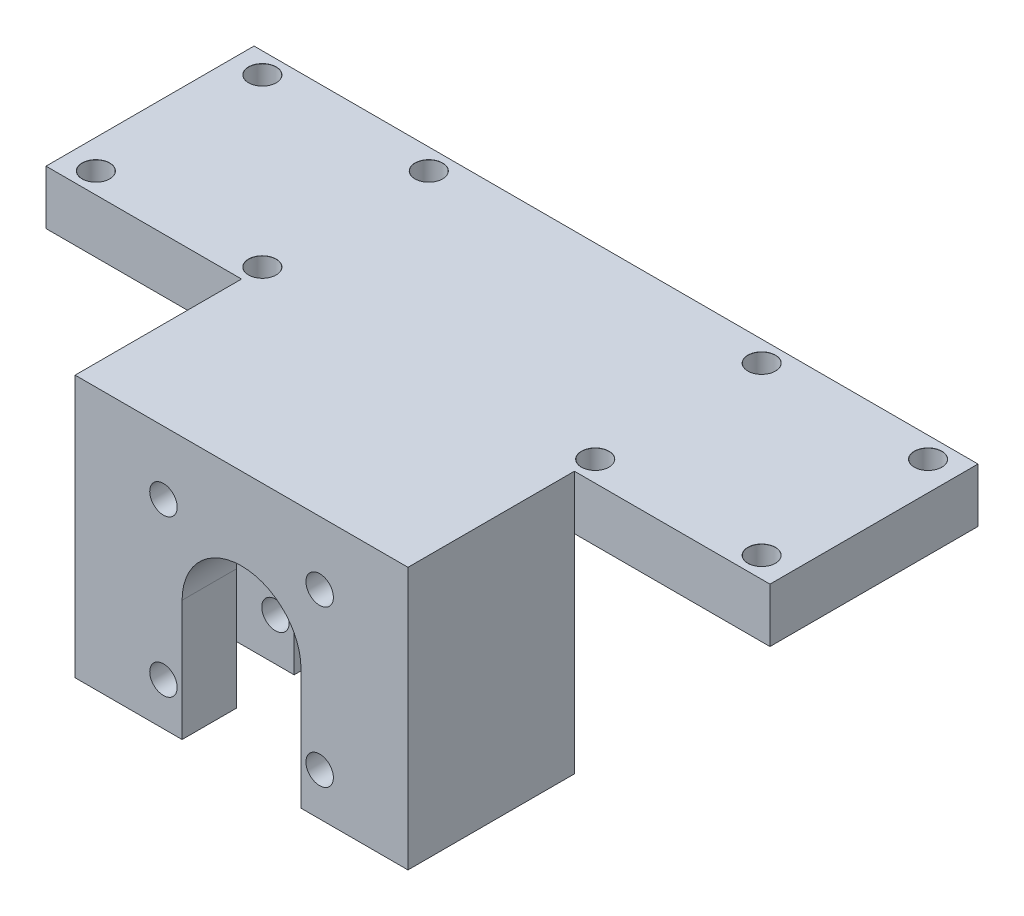
from build123d import *

# Parameters (mm, degrees)
SKETCH1_W                      = 174
SKETCH1_H                      = 50
BOSS_EXTRUDE1_DEPTH            = 13
M6_CLEARANCE_HOLE1_D           = 6.6
M6_CLEARANCE_HOLE1_CSINK_D     = 6.65
M6_CLEARANCE_HOLE1_CSINK_ANGLE = 100
SKETCH6_W                      = 80
SKETCH6_H                      = 13
BOSS_EXTRUDE2_DEPTH            = 40
SKETCH7_W                      = 80
SKETCH7_H                      = 40
BOSS_EXTRUDE3_DEPTH            = 50
CUT_EXTRUDE2_DEPTH             = 120.557517539
CUT_EXTRUDE2_DEPTH_BACK        = 120.557517539
SKETCH9_R                      = 14.29
M6_CLEARANCE_HOLE2_AT_2_COUNT  = 2
M6_CLEARANCE_HOLE2_AT_2_PITCH  = 37.540299013
M6_CLEARANCE_HOLE2_AT_3_COUNT  = 2
M6_CLEARANCE_HOLE2_AT_3_PITCH  = 37.540299013
M6_CLEARANCE_HOLE2_AT_4_COUNT  = 2
M6_CLEARANCE_HOLE2_AT_4_PITCH  = 53.09
CUT_EXTRUDE3_DEPTH             = 6.93
CUT_EXTRUDE3_DEPTH_BACK        = 6.93
SKETCH17_W                     = 28.58
SKETCH17_H                     = 29
CUT_EXTRUDE4_DEPTH             = 135.792433022
CUT_EXTRUDE5_DEPTH             = 50


with BuildPart() as part:
    # Sketch1 → Boss-Extrude1 (new body)
    with BuildSketch(Plane(origin=(0, 0, 0), x_dir=(1, 0, 0), z_dir=(0, 1, 0))):
        Rectangle(SKETCH1_W, SKETCH1_H)
    extrude(amount=BOSS_EXTRUDE1_DEPTH)

    # M6 Clearance Hole1 (through all)
    with Locations(Plane(origin=(0, 13, 0), x_dir=(1, 0, 0), z_dir=(0, 1, 0))):
        with Locations((-80, 20), (-40, 20), (-80, -20), (-40, -20), (40, 20), (80, 20), (40, -20), (80, -20)):
            CounterSinkHole(M6_CLEARANCE_HOLE1_D / 2, M6_CLEARANCE_HOLE1_CSINK_D / 2, counter_sink_angle=M6_CLEARANCE_HOLE1_CSINK_ANGLE)

    # Sketch6 → Boss-Extrude2 (add)
    with BuildSketch(Plane.XY.offset(25)):
        with Locations((0, 6.5)):
            Rectangle(SKETCH6_W, SKETCH6_H)
    extrude(amount=BOSS_EXTRUDE2_DEPTH)

    # Sketch7 → Boss-Extrude3 (add)
    with BuildSketch(Plane.XZ):
        with Locations((0, 45)):
            Rectangle(SKETCH7_W, SKETCH7_H)
    extrude(amount=BOSS_EXTRUDE3_DEPTH)

    # Sketch9 → Cut-Extrude2 (cut, two sides: drawn at the far end of the back side and taken through both)
    with BuildSketch(Plane.XY.offset(-CUT_EXTRUDE2_DEPTH_BACK)):
        with Locations((0, -21)):
            Circle(SKETCH9_R)
    extrude(amount=CUT_EXTRUDE2_DEPTH + CUT_EXTRUDE2_DEPTH_BACK, mode=Mode.SUBTRACT)

    # Sketch13 → M6 Clearance Hole2 (revolve, cut)
    with BuildSketch(Plane(origin=(-18.770149507, -2.229850493, 25), x_dir=(0, 1, 0), z_dir=(1, 0, 0))):
        Polygon((0, 0), (0, 40), (3.3, 40), (3.3, 0.020977491), (3.325, 0), align=None)
    m6_clearance_hole2 = revolve(axis=Axis((-18.770149507, -2.229850493, 18.65), (0, 0, 1)), mode=Mode.SUBTRACT)

    # M6 Clearance Hole2 at 2: M6 Clearance Hole2 ×2
    with Locations(*[(0, -i * M6_CLEARANCE_HOLE2_AT_2_PITCH, 0) for i in range(1, M6_CLEARANCE_HOLE2_AT_2_COUNT)]):
        add(m6_clearance_hole2, mode=Mode.SUBTRACT)

    # M6 Clearance Hole2 at 3: M6 Clearance Hole2 ×2
    with Locations(*[(i * M6_CLEARANCE_HOLE2_AT_3_PITCH, 0, 0) for i in range(1, M6_CLEARANCE_HOLE2_AT_3_COUNT)]):
        add(m6_clearance_hole2, mode=Mode.SUBTRACT)

    # M6 Clearance Hole2 at 4: M6 Clearance Hole2 ×2
    with Locations(*[Vector(0.7071067811865476, -0.7071067811865475, 0) * (i * M6_CLEARANCE_HOLE2_AT_4_PITCH) for i in range(1, M6_CLEARANCE_HOLE2_AT_4_COUNT)]):
        add(m6_clearance_hole2, mode=Mode.SUBTRACT)

    # Sketch16 → Cut-Extrude3 (cut, two sides: drawn at the far end of the back side and taken through both)
    with BuildSketch(Plane.XY.offset(45).offset(-CUT_EXTRUDE3_DEPTH_BACK)):
        with BuildLine():
            Line((-33.22, -21), (-33.22, -50))
            Line((-33.22, -50), (33.22, -50))
            Line((33.22, -50), (33.22, -21))
            ThreePointArc((33.22, -21), (0, 12.22), (-33.22, -21))
        make_face()
    extrude(amount=CUT_EXTRUDE3_DEPTH + CUT_EXTRUDE3_DEPTH_BACK, mode=Mode.SUBTRACT)

    # Sketch17 → Cut-Extrude4 (cut, through all)
    with BuildSketch(Plane.XY.offset(65)):
        with Locations((0, -35.5)):
            Rectangle(SKETCH17_W, SKETCH17_H)
    extrude(amount=-CUT_EXTRUDE4_DEPTH, mode=Mode.SUBTRACT)

    # Sketch19 → Cut-Extrude5 (cut)
    with BuildSketch(Plane(origin=(0, 0, -25), x_dir=(-1, 0, 0), z_dir=(0, 0, -1))):
        Polygon((-30.618301393, 0), (-24.118301393, 6.5), (24.118301393, 6.5), (30.618301393, 0), align=None)
    extrude(amount=-CUT_EXTRUDE5_DEPTH, mode=Mode.SUBTRACT)


solid = part.part
